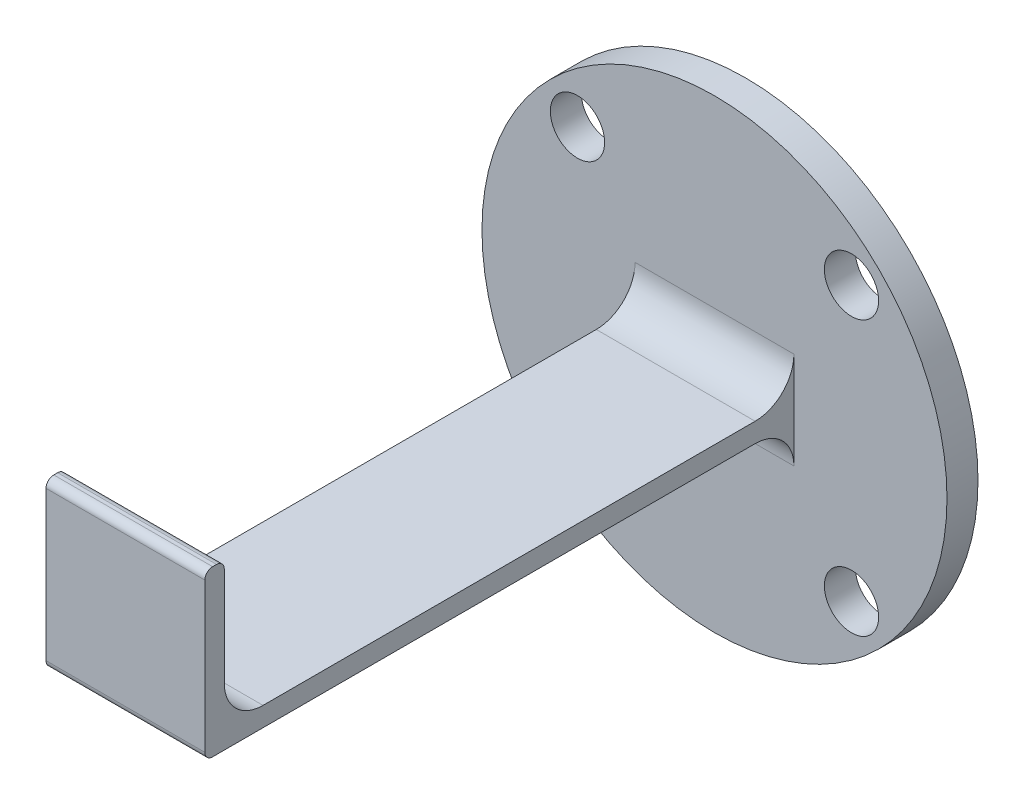
from build123d import *

# Parameters (mm, degrees)
SKETCH_2_R          = 30
EXTRUDE_1_DEPTH     = 4
SKETCH_3_R          = 3.5
CUT_EXTRUDE_1_DEPTH = 4
SKETCH_14_W         = 20.5
SKETCH_14_H         = 2.5
EXTRUDE_2_DEPTH     = 80
SKETCH_15_W         = 20.5
SKETCH_15_H         = 2.5
EXTRUDE_3_DEPTH     = 20
FILLET_1_R          = 5
FILLET_3_R          = 1


with BuildPart() as part:
    # 草图2 → 凸台-拉伸1 (new body)
    with BuildSketch(Plane.XY):
        Circle(SKETCH_2_R)
    extrude(amount=EXTRUDE_1_DEPTH)

    # 草图3 → 切除-拉伸1 (cut)
    with BuildSketch(Plane.XY.offset(4)):
        with Locations((-17.67766953, 17.67766953)):
            Circle(SKETCH_3_R)
        with Locations(Location((17.67766953, 17.67766953, 0), (0, 0, 180))):
            Circle(SKETCH_3_R)
        with Locations((17.67766953, -17.67766953)):
            Circle(SKETCH_3_R)
        with Locations(Location((-17.67766953, -17.67766953, 0), (0, 0, 180))):
            Circle(SKETCH_3_R)
    extrude(amount=-CUT_EXTRUDE_1_DEPTH, mode=Mode.SUBTRACT)

    # 草图14 → 凸台-拉伸2 (add)
    with BuildSketch(Plane.XY):
        Rectangle(SKETCH_14_W, SKETCH_14_H)
    extrude(amount=EXTRUDE_2_DEPTH)

    # 草图15 → 凸台-拉伸3 (add)
    with BuildSketch(Plane(origin=(0, 0, 0), x_dir=(1, 0, 0), z_dir=(0, 1, 0))):
        with Locations((0, -78.75)):
            Rectangle(SKETCH_15_W, SKETCH_15_H)
    extrude(amount=EXTRUDE_3_DEPTH)

    # 圆角1
    fillet_1_edges = [part.edges().sort_by_distance(p)[0] for p in [
        (0, 1.25, 4),
        (0, -1.25, 4),
        (0, 1.25, 77.5),
    ]]
    fillet(fillet_1_edges, radius=FILLET_1_R)

    # 圆角3
    fillet_3_edges = [part.edges().sort_by_distance(p)[0] for p in [
        (0, -1.25, 80),
        (0, 20, 80),
        (0, 20, 77.5),
    ]]
    fillet(fillet_3_edges, radius=FILLET_3_R)


solid = part.part
